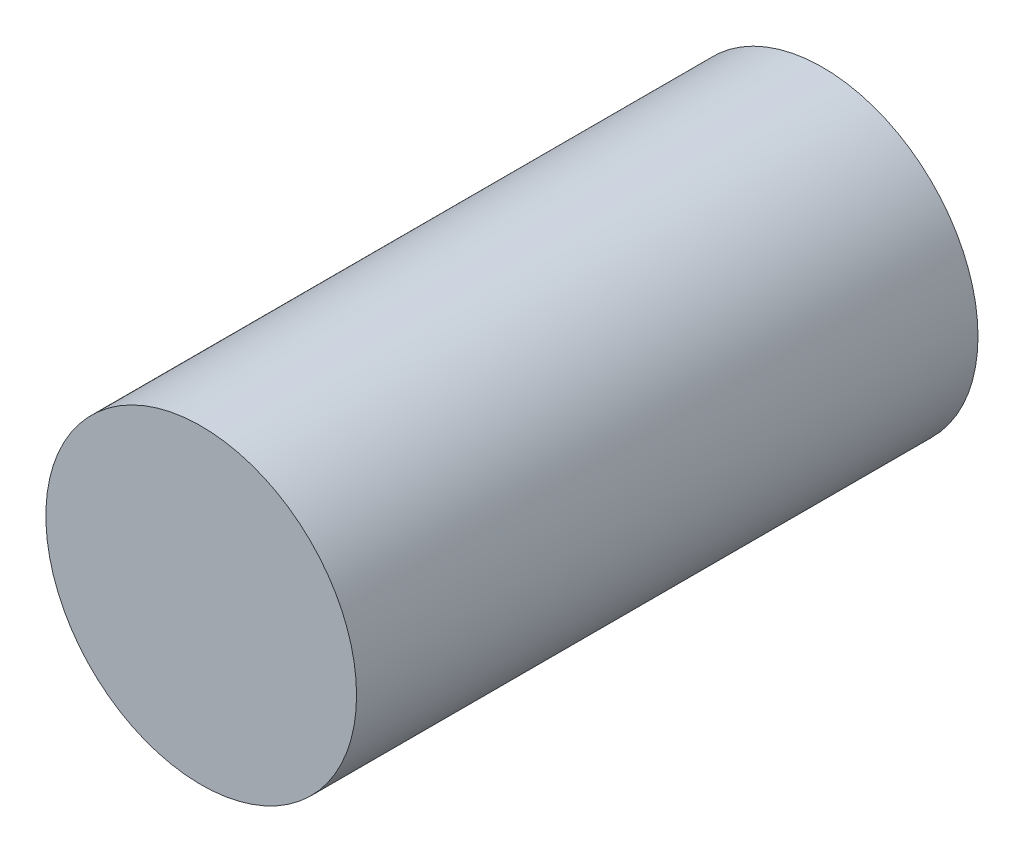
from build123d import *

# Parameters (mm, degrees)
ESBO_O1_R                = 1
RESSALTO_EXTRUS_O1_DEPTH = 4


with BuildPart() as part:
    # Esboço1 → Ressalto-extrusão1 (new body)
    with BuildSketch(Plane.XY):
        Circle(ESBO_O1_R)
    extrude(amount=RESSALTO_EXTRUS_O1_DEPTH)


solid = part.part
